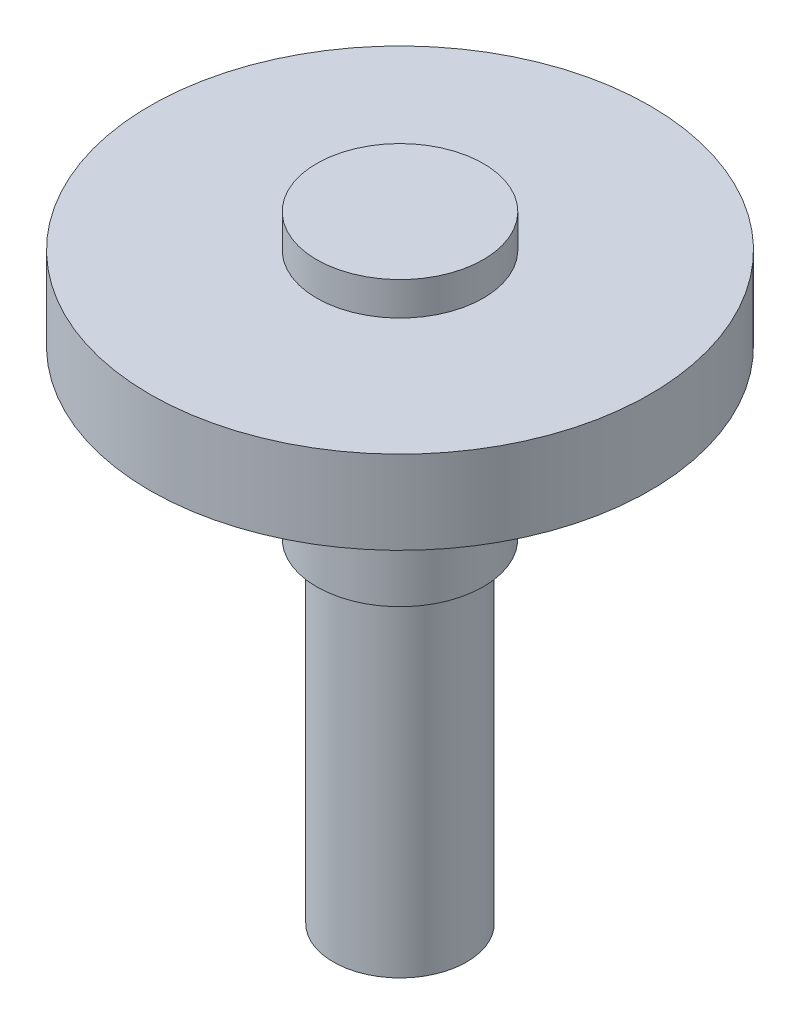
from build123d import *

# Parameters (mm, degrees)
SKETCH1_R           = 15
BOSS_EXTRUDE1_DEPTH = 5
SKETCH3_R           = 5
BOSS_EXTRUDE2_DEPTH = 2
BOSS_EXTRUDE3_START = 10
SKETCH2_R           = 5
BOSS_EXTRUDE3_DEPTH = 10
SKETCH4_R           = 4
BOSS_EXTRUDE4_DEPTH = 20


with BuildPart() as part:
    # Sketch1 → Boss-Extrude1 (new body)
    with BuildSketch(Plane(origin=(0, 0, 0), x_dir=(1, 0, 0), z_dir=(0, 1, 0))):
        with Locations(Location((0, 0, 0), (0, 0, 270))):
            Circle(SKETCH1_R)
    extrude(amount=BOSS_EXTRUDE1_DEPTH)

    # Sketch3 → Boss-Extrude2 (add)
    with BuildSketch(Plane(origin=(0, 5, 0), x_dir=(1, 0, 0), z_dir=(0, 1, 0))):
        with Locations(Location((0, 0, 0), (0, 0, 270))):
            Circle(SKETCH3_R)
    extrude(amount=BOSS_EXTRUDE2_DEPTH)

    # Sketch2 → Boss-Extrude3 (add)
    with BuildSketch(Plane.XZ.offset(BOSS_EXTRUDE3_START)):
        with Locations(Location((0, 0, 0), (0, 0, 90))):
            Circle(SKETCH2_R)
    extrude(amount=-BOSS_EXTRUDE3_DEPTH)

    # Sketch4 → Boss-Extrude4 (add)
    with BuildSketch(Plane.XZ.offset(10)):
        with Locations(Location((0, 0, 0), (0, 0, 270))):
            Circle(SKETCH4_R)
    extrude(amount=BOSS_EXTRUDE4_DEPTH)


solid = part.part
